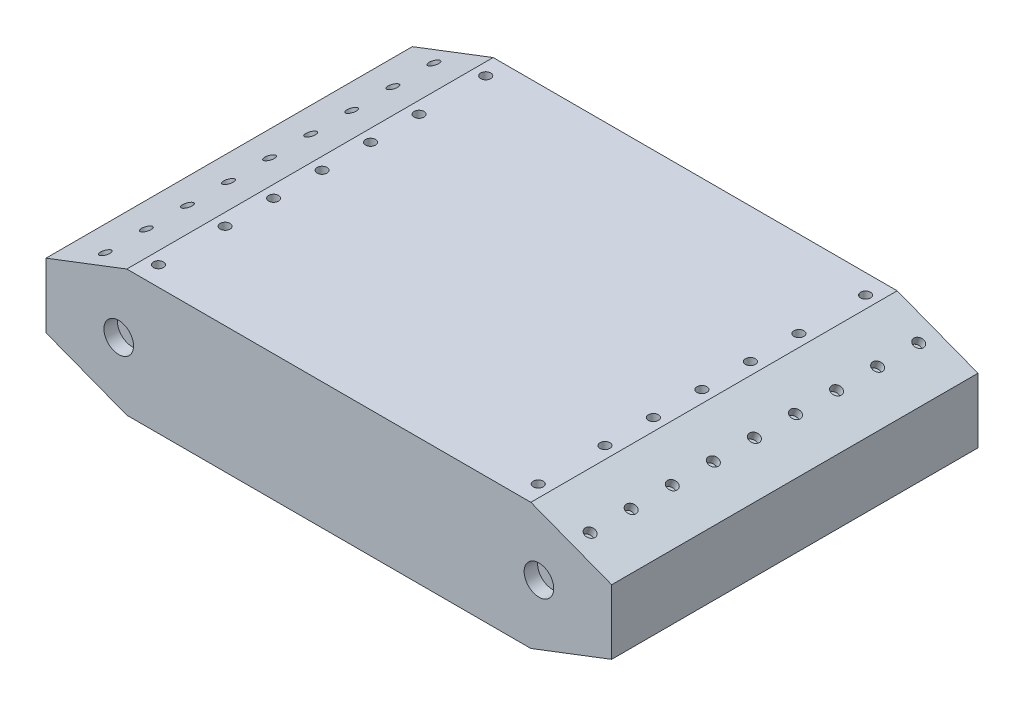
from build123d import *

# Parameters (mm, degrees)
BOSS_EXTRUDE1_DEPTH = 136
SKETCH5_R           = 5.5
LEFTWHEELS_DEPTH    = 5
RIGHTWHEELS_START   = -5
SKETCH6_R           = 5.5
RIGHTWHEELS_DEPTH   = 5
SKETCH7_R           = 1.9
FRONTHOLES_DEPTH    = 3
SKETCH8_R           = 1.85
TOPHOLES_DEPTH      = 3


with BuildPart() as part:
    # Sketch3 → Boss-Extrude1 (new body)
    with BuildSketch(Plane.XY):
        Polygon((-75, 23.5), (-105, 12), (-105, -12), (-75, -23.5), (75, -23.5), (105, -12), (105, 12), (75, 23.5), align=None)
    extrude(amount=BOSS_EXTRUDE1_DEPTH)

    # Sketch5 → LeftWheels (cut)
    with BuildSketch(Plane.XY.offset(136)):
        with Locations((78, 0)):
            Circle(SKETCH5_R)
        with Locations(Location((-78, 0, 0), (0, 0, 180))):
            Circle(SKETCH5_R)
    extrude(amount=-LEFTWHEELS_DEPTH, mode=Mode.SUBTRACT)

    # Sketch6 → RightWheels (cut)
    with BuildSketch(Plane(origin=(0, 0, 0), x_dir=(-1, 0, 0), z_dir=(0, 0, -1)).offset(RIGHTWHEELS_START)):
        with Locations((78, 0)):
            Circle(SKETCH6_R)
        with Locations(Location((-78, 0, 0), (0, 0, 180))):
            Circle(SKETCH6_R)
    extrude(amount=RIGHTWHEELS_DEPTH, mode=Mode.SUBTRACT)

    # Sketch7 → FrontHoles (cut)
    with BuildSketch(Plane(origin=(17.463066118, 45.555824655, 0), x_dir=(0.9337461173020496, -0.3579360116324526, 0), z_dir=(0.3579360116324526, 0.9337461173020496, 0))):
        with Locations(Location((77.683786351, -7, 0), (0, 0, 180))):
            Circle(SKETCH7_R)
        with Locations(Location((77.683786351, -22.25, 0), (0, 0, 180))):
            Circle(SKETCH7_R)
        with Locations(Location((77.683786351, -37.5, 0), (0, 0, 180))):
            Circle(SKETCH7_R)
        with Locations(Location((77.683786351, -52.75, 0), (0, 0, 180))):
            Circle(SKETCH7_R)
        with Locations(Location((77.683786351, -68, 0), (0, 0, 180))):
            Circle(SKETCH7_R)
        with Locations(Location((77.683786351, -83.25, 0), (0, 0, 180))):
            Circle(SKETCH7_R)
        with Locations(Location((77.683786351, -98.5, 0), (0, 0, 180))):
            Circle(SKETCH7_R)
        with Locations(Location((77.683786351, -113.75, 0), (0, 0, 180))):
            Circle(SKETCH7_R)
        with Locations(Location((77.683786351, -129, 0), (0, 0, 180))):
            Circle(SKETCH7_R)
    frontholes = extrude(amount=-FRONTHOLES_DEPTH, mode=Mode.SUBTRACT)

    # BackHoles: FrontHoles across plane
    add(frontholes.mirror(Plane(origin=(0, 0, 0), x_dir=(0, 0, 1), z_dir=(1, 0, 0))), mode=Mode.SUBTRACT)

    # Sketch8 → TopHoles (cut)
    with BuildSketch(Plane(origin=(0, 23.5, 0), x_dir=(1, 0, 0), z_dir=(0, 1, 0))):
        with Locations(Location((70.5, -7.25, 0), (0, 0, 180))):
            Circle(SKETCH8_R)
        with Locations(Location((70.5, -32, 0), (0, 0, 180))):
            Circle(SKETCH8_R)
        with Locations(Location((70.5, -50, 0), (0, 0, 180))):
            Circle(SKETCH8_R)
        with Locations(Location((70.5, -68, 0), (0, 0, 180))):
            Circle(SKETCH8_R)
        with Locations(Location((70.5, -86, 0), (0, 0, 180))):
            Circle(SKETCH8_R)
        with Locations(Location((70.5, -104, 0), (0, 0, 180))):
            Circle(SKETCH8_R)
        with Locations(Location((70.5, -128.75, 0), (0, 0, 180))):
            Circle(SKETCH8_R)
        with Locations((-70.5, -128.75)):
            Circle(SKETCH8_R)
        with Locations((-70.5, -104)):
            Circle(SKETCH8_R)
        with Locations((-70.5, -86)):
            Circle(SKETCH8_R)
        with Locations((-70.5, -68)):
            Circle(SKETCH8_R)
        with Locations((-70.5, -50)):
            Circle(SKETCH8_R)
        with Locations((-70.5, -32)):
            Circle(SKETCH8_R)
        with Locations((-70.5, -7.25)):
            Circle(SKETCH8_R)
    extrude(amount=-TOPHOLES_DEPTH, mode=Mode.SUBTRACT)


solid = part.part
